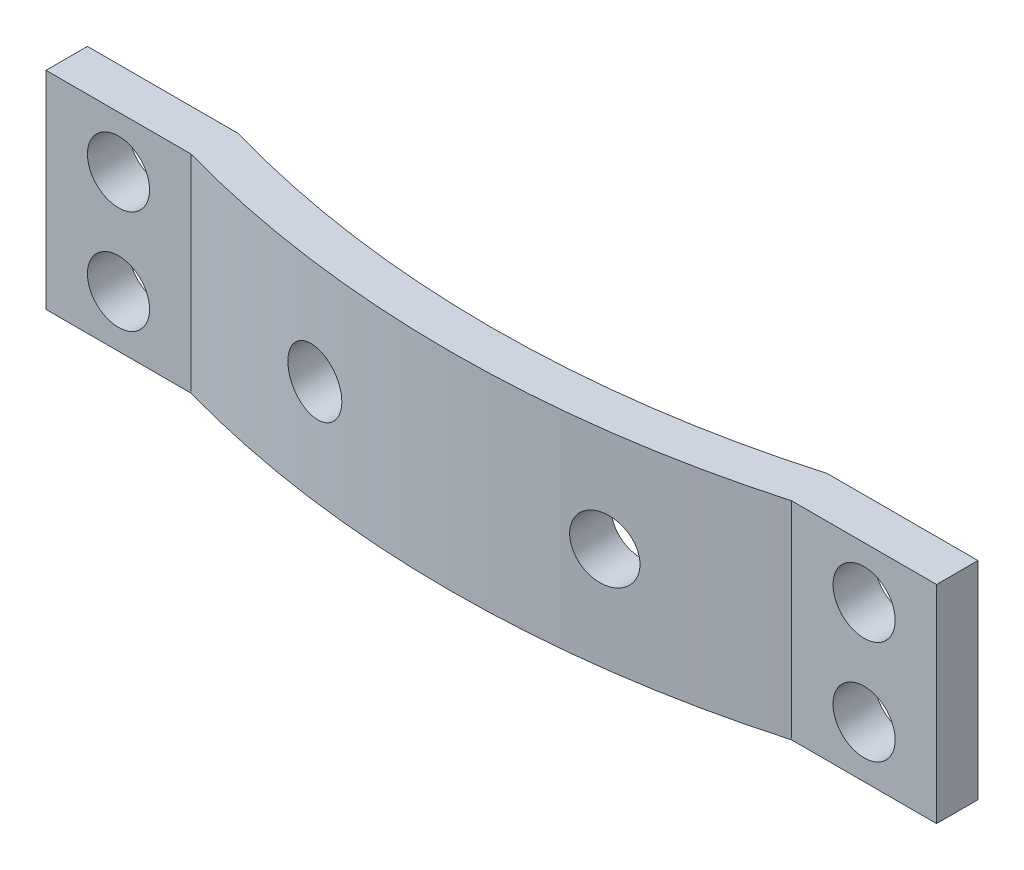
from build123d import *

# Parameters (mm, degrees)
EXTRUDE_1_DEPTH     = 10
SKETCH_2_R          = 1.5
CUT_EXTRUDE_1_DEPTH = 2
SKETCH_4_R          = 1.5
CUT_EXTRUDE_3_DEPTH = 3


with BuildPart() as part:
    # Эскиз1 → Вытянуть-Тонкостенный1 (new body)
    with BuildSketch(Plane(origin=(0, 0, 0), x_dir=(1, 0, 0), z_dir=(0, 1, 0))):
        with BuildLine():
            Line((0, 0), (-7, 0))
            ThreePointArc((-7, 0), (-21.5, -2), (-36, 0))
            Line((-36, 0), (-43, 0))
            Line((-43, 0), (-43, 2))
            Line((-43, 2), (-35.721462653, 2))
            ThreePointArc((-35.721462653, 2), (-21.5, 0), (-7.278537347, 2))
            Line((-7.278537347, 2), (0, 2))
            Line((0, 2), (0, 0))
        make_face()
    extrude(amount=EXTRUDE_1_DEPTH)

    # Эскиз2 → Вырез-Вытянуть1 (cut)
    with BuildSketch(Plane.XY):
        with Locations((-39.5, 7.5)):
            Circle(SKETCH_2_R)
        with Locations((-39.5, 2.5)):
            Circle(SKETCH_2_R)
        with Locations((-3.5, 7.5)):
            Circle(SKETCH_2_R)
        with Locations((-3.5, 2.5)):
            Circle(SKETCH_2_R)
    extrude(amount=-CUT_EXTRUDE_1_DEPTH, mode=Mode.SUBTRACT)

    # Эскиз4 → Вырез-Вытянуть3 (cut)
    with BuildSketch(Plane.XY.offset(2)):
        with Locations((-28.5, 5)):
            Circle(SKETCH_4_R)
        with Locations((-14.5, 5)):
            Circle(SKETCH_4_R)
    extrude(amount=-CUT_EXTRUDE_3_DEPTH, mode=Mode.SUBTRACT)


solid = part.part
